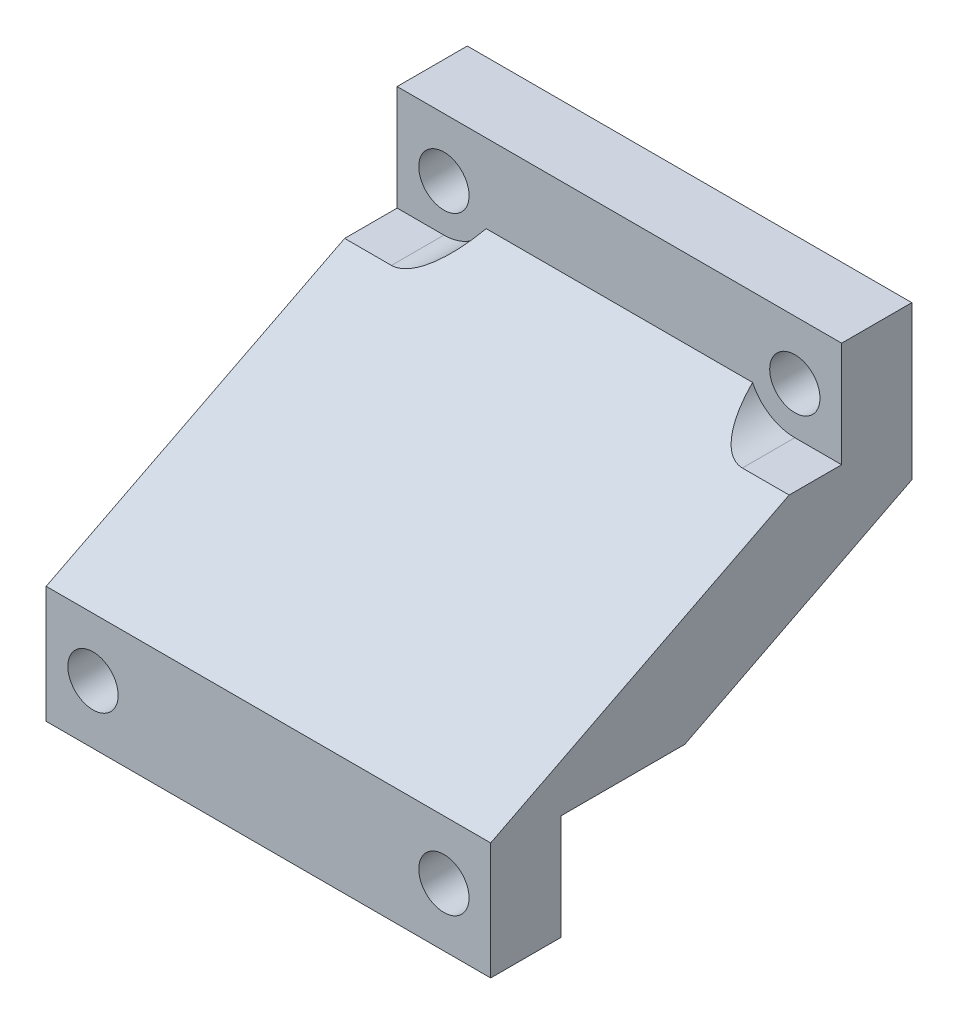
from build123d import *

# Parameters (mm, degrees)
BOSS_EXTRUDE1_DEPTH     = 19
CUT_EXTRUDE1_DEPTH      = 48.801673611
CUT_EXTRUDE1_DEPTH_BACK = 48.801673611
SKETCH5_R               = 2.15
SKETCH6_R               = 2.15
CUT_EXTRUDE2_DEPTH      = 6
CUT_EXTRUDE6_DEPTH      = 48.801673611
CUT_EXTRUDE7_DEPTH      = 36


with BuildPart() as part:
    # Sketch2 → Boss-Extrude1 (new, symmetric)
    with BuildSketch(Plane(origin=(0, 0, 0), x_dir=(0, 0, -1), z_dir=(1, 0, 0))):
        Polygon((0, 0), (6, 0), (6, 3.6), (36, 18.885763485), (36, 32), (30, 32), (30, 25.285763485), (0, 10), align=None)
    extrude(amount=BOSS_EXTRUDE1_DEPTH, both=True)

    # Sketch5 → Cut-Extrude1 (cut, two sides: drawn at the far end of the back side and taken through both)
    with BuildSketch(Plane.XY.offset(-30).offset(-CUT_EXTRUDE1_DEPTH_BACK)):
        with Locations((-15, 27)):
            Circle(SKETCH5_R)
        with Locations(Location((15, 27, 0), (0, 0, 307.125127623))):
            Circle(SKETCH5_R)
    extrude(amount=CUT_EXTRUDE1_DEPTH + CUT_EXTRUDE1_DEPTH_BACK, mode=Mode.SUBTRACT)

    # Sketch6 → Cut-Extrude2 (cut)
    with BuildSketch(Plane.XY):
        with Locations((-15, 5)):
            Circle(SKETCH6_R)
        with Locations(Location((15, 5, 0), (0, 0, 319.370671217))):
            Circle(SKETCH6_R)
    extrude(amount=-CUT_EXTRUDE2_DEPTH, mode=Mode.SUBTRACT)

    # Sketch9 → Cut-Extrude6 (cut, through all)
    with BuildSketch(Plane(origin=(0, 0, -6), x_dir=(-1, 0, 0), z_dir=(0, 0, -1))):
        with BuildLine():
            Line((-19, 0), (-19, 9))
            Line((-19, 9), (-15, 9))
            ThreePointArc((-15, 9), (-12.171572875, 7.828427125), (-11, 5))
            Line((-11, 5), (-11, 0))
            Line((-11, 0), (-19, 0))
        make_face()
        with BuildLine():
            Line((19, 0), (19, 9))
            Line((19, 9), (15, 9))
            ThreePointArc((15, 9), (12.171572875, 7.828427125), (11, 5))
            Line((11, 5), (11, 0))
            Line((11, 0), (19, 0))
        make_face()
    extrude(amount=CUT_EXTRUDE6_DEPTH, mode=Mode.SUBTRACT)

    # Sketch11 → Cut-Extrude7 (cut)
    with BuildSketch(Plane.XY.offset(-30)):
        with BuildLine():
            Line((11, 32), (19, 32))
            Line((19, 32), (19, 23))
            Line((19, 23), (15, 23))
            ThreePointArc((15, 23), (12.171572875, 24.171572875), (11, 27))
            Line((11, 27), (11, 32))
        make_face()
        with BuildLine():
            Line((-19, 23), (-15, 23))
            ThreePointArc((-15, 23), (-12.171572875, 24.171572875), (-11, 27))
            Line((-11, 27), (-11, 32))
            Line((-11, 32), (-19, 32))
            Line((-19, 32), (-19, 23))
        make_face()
    extrude(amount=CUT_EXTRUDE7_DEPTH, mode=Mode.SUBTRACT)


solid = part.part
